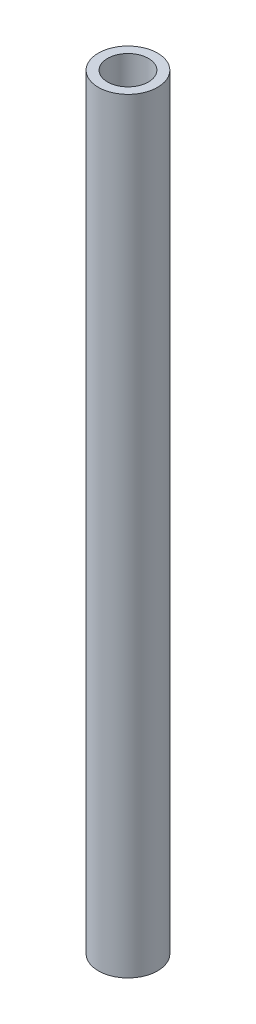
from build123d import *

# Parameters (mm, degrees)
SKETCH1_R           = 4.7625
SKETCH1_R_2         = 3.2893
BOSS_EXTRUDE1_DEPTH = 123


with BuildPart() as part:
    # Sketch1 → Boss-Extrude1 (new body)
    with BuildSketch(Plane(origin=(0, 0, 0), x_dir=(1, 0, 0), z_dir=(0, 1, 0))):
        with Locations(Location((0, 0, 0), (0, 0, 270))):
            Circle(SKETCH1_R)
        with Locations(Location((0, 0, 0), (0, 0, 270))):
            Circle(SKETCH1_R_2, mode=Mode.SUBTRACT)
    extrude(amount=BOSS_EXTRUDE1_DEPTH)


solid = part.part
